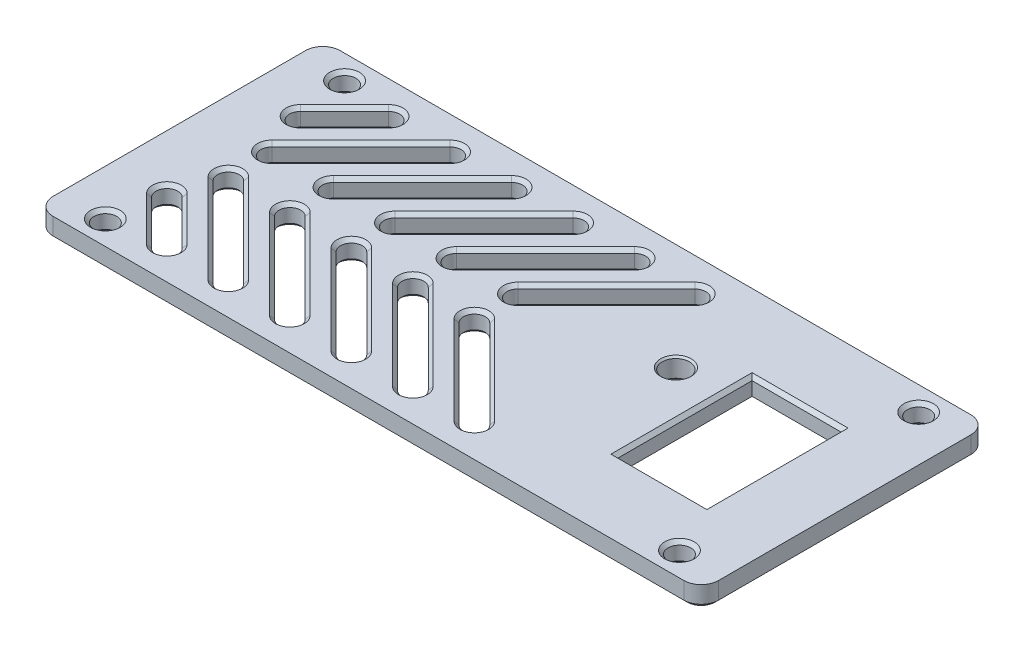
from build123d import *

# Parameters (mm, degrees)
SKETCH1_W           = 97.155
SKETCH1_H           = 41.91
BOSS_EXTRUDE1_DEPTH = 3
FILLET1_R           = 2.54
SKETCH2_W           = 13
SKETCH2_H           = 19.6
CUT_EXTRUDE1_DEPTH  = 53.989485101
SKETCH3_R           = 1.651
CUT_EXTRUDE2_DEPTH  = 53.989485101
SKETCH4_R           = 1.9812
CUT_EXTRUDE3_DEPTH  = 3.175
CHAMFER1_SIZE       = 0.254
CUT_EXTRUDE4_DEPTH  = 53.989485101
CHAMFER2_SIZE       = 0.508
CHAMFER3_SIZE       = 0.508
CHAMFER4_SIZE       = 0.508
CHAMFER5_SIZE       = 0.508


with BuildPart() as part:
    # Sketch1 → Boss-Extrude1 (new body)
    with BuildSketch(Plane(origin=(0, 0, 0), x_dir=(1, 0, 0), z_dir=(0, 1, 0))):
        Rectangle(SKETCH1_W, SKETCH1_H)
    extrude(amount=BOSS_EXTRUDE1_DEPTH)

    # Fillet1
    fillet1_edges = [part.edges().sort_by_distance(p)[0] for p in [
        (-48.5775, 1.5, -20.955),
        (48.5775, 1.5, -20.955),
        (48.5775, 1.5, 20.955),
        (-48.5775, 1.5, 20.955),
    ]]
    fillet(fillet1_edges, radius=FILLET1_R)

    # Sketch2 → Cut-Extrude1 (cut, through all)
    with BuildSketch(Plane(origin=(0, 3, 0), x_dir=(1, 0, 0), z_dir=(0, 1, 0))):
        with Locations((31.75, 0)):
            Rectangle(SKETCH2_W, SKETCH2_H)
    extrude(amount=-CUT_EXTRUDE1_DEPTH, mode=Mode.SUBTRACT)

    # Sketch3 → Cut-Extrude2 (cut, through all)
    with BuildSketch(Plane(origin=(0, 3, 0), x_dir=(1, 0, 0), z_dir=(0, 1, 0))):
        with Locations(Location((-41.91, 17.4625, 0), (0, 0, 270))):
            Circle(SKETCH3_R)
        with Locations(Location((-41.91, -17.4625, 0), (0, 0, 270))):
            Circle(SKETCH3_R)
        with Locations(Location((41.91, -17.4625, 0), (0, 0, 270))):
            Circle(SKETCH3_R)
        with Locations(Location((41.91, 17.4625, 0), (0, 0, 270))):
            Circle(SKETCH3_R)
    extrude(amount=-CUT_EXTRUDE2_DEPTH, mode=Mode.SUBTRACT)

    # Sketch4 → Cut-Extrude3 (cut)
    with BuildSketch(Plane.XZ):
        with Locations(Location((18.542, -5.3848, 0), (0, 0, 270))):
            Circle(SKETCH4_R)
    extrude(amount=-CUT_EXTRUDE3_DEPTH, mode=Mode.SUBTRACT)

    # Chamfer1
    chamfer1_edges = [part.edges().sort_by_distance(p)[0] for p in [
        (18.542, 3, -3.4036),
        (18.542, 0, -3.4036),
    ]]
    chamfer(chamfer1_edges, length=CHAMFER1_SIZE)

    # Sketch5 → Cut-Extrude4 (cut, through all)
    with BuildSketch(Plane.XZ):
        with BuildLine():
            Line((-41.762532015, 10.874775894), (-35.322275894, 17.315032015))
            ThreePointArc((-35.322275894, 17.315032015), (-33.077211864, 17.315032015), (-33.077211864, 15.069967985))
            Line((-33.077211864, 15.069967985), (-39.517467985, 8.629711864))
            ThreePointArc((-39.517467985, 8.629711864), (-41.762532015, 8.629711864), (-41.762532015, 10.874775894))
        make_face()
        with BuildLine():
            Line((-39.359519773, 4.297532015), (-26.342019773, 17.315032015))
            ThreePointArc((-26.342019773, 17.315032015), (-24.096955743, 17.315032015), (-24.096955743, 15.069967985))
            Line((-24.096955743, 15.069967985), (-37.114455743, 2.052467985))
            ThreePointArc((-37.114455743, 2.052467985), (-39.359519773, 2.052467985), (-39.359519773, 4.297532015))
        make_face()
        with BuildLine():
            Line((-30.379263652, 4.297532015), (-17.361763652, 17.315032015))
            ThreePointArc((-17.361763652, 17.315032015), (-15.116699622, 17.315032015), (-15.116699622, 15.069967985))
            Line((-15.116699622, 15.069967985), (-28.134199622, 2.052467985))
            ThreePointArc((-28.134199622, 2.052467985), (-30.379263652, 2.052467985), (-30.379263652, 4.297532015))
        make_face()
        with BuildLine():
            Line((-21.399007531, 4.297532015), (-8.381507531, 17.315032015))
            ThreePointArc((-8.381507531, 17.315032015), (-6.136443501, 17.315032015), (-6.136443501, 15.069967985))
            Line((-6.136443501, 15.069967985), (-19.153943501, 2.052467985))
            ThreePointArc((-19.153943501, 2.052467985), (-21.399007531, 2.052467985), (-21.399007531, 4.297532015))
        make_face()
        with BuildLine():
            Line((-12.41875141, 4.297532015), (0.59874859, 17.315032015))
            ThreePointArc((0.59874859, 17.315032015), (2.84381262, 17.315032015), (2.84381262, 15.069967985))
            Line((2.84381262, 15.069967985), (-10.17368738, 2.052467985))
            ThreePointArc((-10.17368738, 2.052467985), (-12.41875141, 2.052467985), (-12.41875141, 4.297532015))
        make_face()
        with BuildLine():
            Line((-3.438495289, 4.297532015), (9.481967985, 17.217995289))
            ThreePointArc((9.481967985, 17.217995289), (11.727032015, 17.217995289), (11.727032015, 14.972931258))
            Line((11.727032015, 14.972931258), (-1.193431258, 2.052467985))
            ThreePointArc((-1.193431258, 2.052467985), (-3.438495289, 2.052467985), (-3.438495289, 4.297532015))
        make_face()
    cut_extrude4 = extrude(amount=-CUT_EXTRUDE4_DEPTH, mode=Mode.SUBTRACT)

    # Mirror1: Cut-Extrude4 across plane
    add(cut_extrude4.mirror(Plane.XY), mode=Mode.SUBTRACT)

    # Chamfer2
    chamfer2_edges = [part.edges().sort_by_distance(p)[0] for p in [
        (25.25, 0, 0),
        (31.75, 0, -9.8),
        (38.25, 0, 0),
        (31.75, 0, 9.8),
        (25.25, 3, 0),
        (31.75, 3, 9.8),
        (38.25, 3, 0),
        (31.75, 3, -9.8),
    ]]
    chamfer(chamfer2_edges, length=CHAMFER2_SIZE)

    # Chamfer3
    chamfer3_edges = [part.edges().sort_by_distance(p)[0] for p in [
        (-6.136443501, 3, 17.315032015),
        (-12.645193501, 3, 8.561217985),
        (-21.399007531, 3, 2.052467985),
        (-14.890257531, 3, 10.806282015),
        (-6.136443501, 0, 17.315032015),
        (-14.890257531, 0, 10.806282015),
        (-21.399007531, 0, 2.052467985),
        (-12.645193501, 0, 8.561217985),
        (2.84381262, 3, 17.315032015),
        (-3.66493738, 3, 8.561217985),
        (-12.41875141, 3, 2.052467985),
        (-5.91000141, 3, 10.806282015),
        (2.84381262, 0, 17.315032015),
        (-5.91000141, 0, 10.806282015),
        (-12.41875141, 0, 2.052467985),
        (-3.66493738, 0, 8.561217985),
        (-24.096955743, 3, 17.315032015),
        (-30.605705743, 3, 8.561217985),
        (-39.359519773, 3, 2.052467985),
        (-32.850769773, 3, 10.806282015),
        (-24.096955743, 0, 17.315032015),
        (-32.850769773, 0, 10.806282015),
        (-39.359519773, 0, 2.052467985),
        (-30.605705743, 0, 8.561217985),
        (-15.116699622, 3, 17.315032015),
        (-21.625449622, 3, 8.561217985),
        (-30.379263652, 3, 2.052467985),
        (-23.870513652, 3, 10.806282015),
        (-15.116699622, 0, 17.315032015),
        (-23.870513652, 0, 10.806282015),
        (-30.379263652, 0, 2.052467985),
        (-21.625449622, 0, 8.561217985),
        (11.727032015, 3, 17.217995289),
        (5.266800378, 3, 8.512699622),
        (-3.438495289, 3, 2.052467985),
        (3.021736348, 3, 10.757763652),
        (11.727032015, 0, 17.217995289),
        (3.021736348, 0, 10.757763652),
        (-3.438495289, 0, 2.052467985),
        (5.266800378, 0, 8.512699622),
        (-33.077211864, 3, 17.315032015),
        (-36.297339924, 3, 11.849839924),
        (-41.762532015, 3, 8.629711864),
        (-38.542403955, 3, 14.094903955),
        (-33.077211864, 0, 17.315032015),
        (-38.542403955, 0, 14.094903955),
        (-41.762532015, 0, 8.629711864),
        (-36.297339924, 0, 11.849839924),
        (-6.136443501, 0, -17.315032015),
        (-14.890257531, 0, -10.806282015),
        (-21.399007531, 0, -2.052467985),
        (-12.645193501, 0, -8.561217985),
        (-6.136443501, 3, -17.315032015),
        (-14.890257531, 3, -10.806282015),
        (-21.399007531, 3, -2.052467985),
        (-12.645193501, 3, -8.561217985),
        (2.84381262, 0, -17.315032015),
        (-5.91000141, 0, -10.806282015),
        (-12.41875141, 0, -2.052467985),
        (-3.66493738, 0, -8.561217985),
        (2.84381262, 3, -17.315032015),
        (-5.91000141, 3, -10.806282015),
        (-12.41875141, 3, -2.052467985),
        (-3.66493738, 3, -8.561217985),
        (-24.096955743, 0, -17.315032015),
        (-32.850769773, 0, -10.806282015),
        (-39.359519773, 0, -2.052467985),
        (-30.605705743, 0, -8.561217985),
        (-24.096955743, 3, -17.315032015),
        (-32.850769773, 3, -10.806282015),
        (-39.359519773, 3, -2.052467985),
        (-30.605705743, 3, -8.561217985),
        (-15.116699622, 0, -17.315032015),
        (-23.870513652, 0, -10.806282015),
        (-30.379263652, 0, -2.052467985),
        (-21.625449622, 0, -8.561217985),
        (-15.116699622, 3, -17.315032015),
        (-23.870513652, 3, -10.806282015),
        (-30.379263652, 3, -2.052467985),
        (-21.625449622, 3, -8.561217985),
        (11.727032015, 0, -17.217995289),
        (3.021736348, 0, -10.757763652),
        (-3.438495289, 0, -2.052467985),
        (5.266800378, 0, -8.512699622),
        (11.727032015, 3, -17.217995289),
        (3.021736348, 3, -10.757763652),
        (-3.438495289, 3, -2.052467985),
        (5.266800378, 3, -8.512699622),
        (-33.077211864, 0, -17.315032015),
        (-38.542403955, 0, -14.094903955),
        (-41.762532015, 0, -8.629711864),
        (-36.297339924, 0, -11.849839924),
        (-33.077211864, 3, -17.315032015),
        (-38.542403955, 3, -14.094903955),
        (-41.762532015, 3, -8.629711864),
        (-36.297339924, 3, -11.849839924),
    ]]
    chamfer(chamfer3_edges, length=CHAMFER3_SIZE)

    # Chamfer4
    chamfer4_edges = [part.edges().sort_by_distance(p)[0] for p in [
        (41.91, 0, -19.1135),
        (41.91, 3, -19.1135),
        (41.91, 0, 15.8115),
        (41.91, 3, 15.8115),
        (-41.91, 0, 15.8115),
        (-41.91, 3, 15.8115),
        (-41.91, 0, -19.1135),
        (-41.91, 3, -19.1135),
    ]]
    chamfer(chamfer4_edges, length=CHAMFER4_SIZE)

    # Chamfer5
    chamfer5_edges = [part.edges().sort_by_distance(p)[0] for p in [
        (0, 0, -20.955),
        (-48.5775, 0, 0),
        (48.5775, 0, 0),
        (0, 0, 20.955),
        (-47.833551224, 0, -20.211051224),
        (-47.833551224, 0, 20.211051224),
        (47.833551224, 0, 20.211051224),
        (47.833551224, 0, -20.211051224),
    ]]
    chamfer(chamfer5_edges, length=CHAMFER5_SIZE)


solid = part.part
